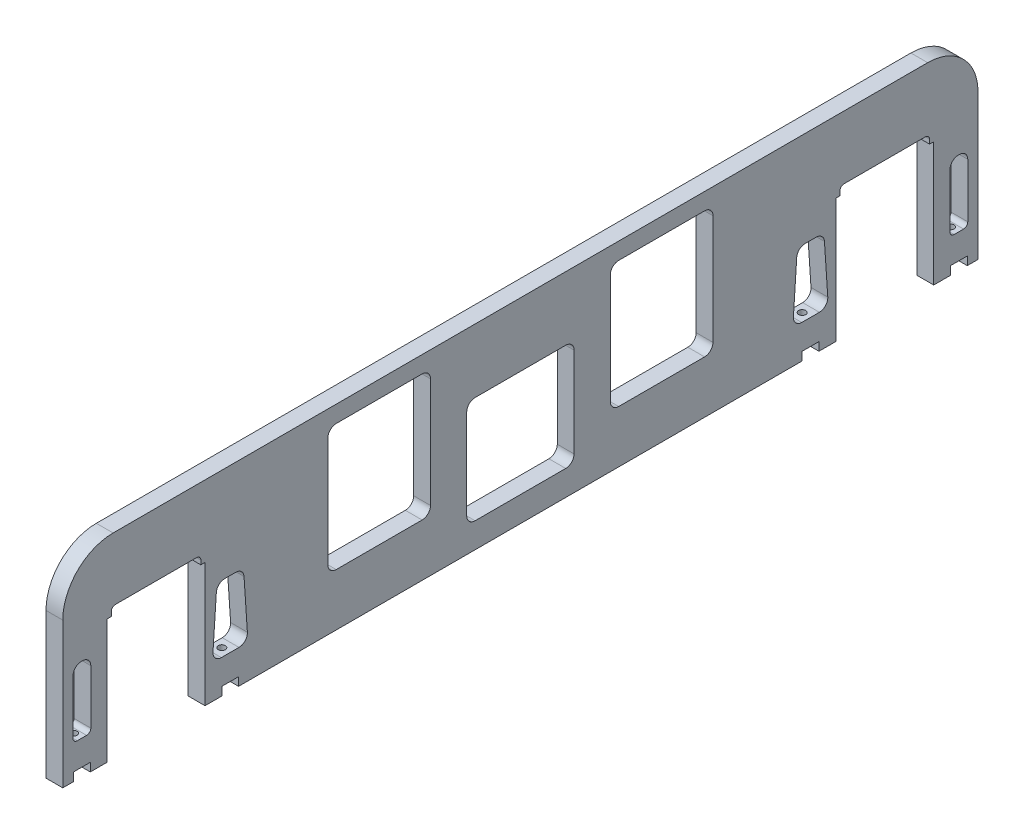
from build123d import *

# Parameters (mm, degrees)
BOSS_EXTRUDE1_DEPTH       = 6.35
FILLET1_R                 = 19.05
SKETCH2_W                 = 33.909
SKETCH2_H                 = 3.175
CUT_EXTRUDE1_DEPTH        = 189.494912836
FILLET2_R                 = 1.5875
FILLET2_OF_MIRROR1_R      = 1.5875
SKETCH3_W                 = 6.35
SKETCH3_H                 = 3.175
CUT_EXTRUDE2_DEPTH        = 189.494912836
SKETCH4_W                 = 38.862
SKETCH4_H                 = 47.879
SKETCH4_W_2               = 40.64
SKETCH4_H_2               = 40.386
CUT_EXTRUDE3_DEPTH        = 189.494912836
FILLET3_R                 = 3.175
SKETCH5_W                 = 6.731
SKETCH5_H                 = 25.24125
CUT_EXTRUDE4_DEPTH        = 189.494912836
FILLET4_R                 = 3.175
FILLET5_R                 = 1.5875
F_6_32_TAPPED_HOLE1_D     = 2.7051
F_6_32_TAPPED_HOLE1_DEPTH = 13.335
F_6_32_TAPPED_HOLE1_TIP   = 0.81269403


with BuildPart() as part:
    # Sketch1 → Boss-Extrude1 (new body)
    with BuildSketch(Plane(origin=(0, 0, 0), x_dir=(0, 0, -1), z_dir=(1, 0, 0))):
        Polygon((173.228, 74.041), (173.228, 0), (156.464, 0), (156.464, 46.99), (119.38, 46.99), (119.38, 0), (-119.38, 0), (-119.38, 46.99), (-156.464, 46.99), (-156.464, 0), (-173.228, 0), (-173.228, 74.041), align=None)
    extrude(amount=BOSS_EXTRUDE1_DEPTH)

    # Fillet1
    fillet1_edges = [part.edges().sort_by_distance(p)[0] for p in [
        (3.175, 74.041, 173.228),
        (3.175, 74.041, -173.228),
    ]]
    fillet(fillet1_edges, radius=FILLET1_R)

    # Sketch2 → Cut-Extrude1 (cut, through all)
    with BuildSketch(Plane(origin=(6.35, 0, 0), x_dir=(0, 0, -1), z_dir=(1, 0, 0))):
        with Locations((-137.922, 48.5775)):
            Rectangle(SKETCH2_W, SKETCH2_H)
    cut_extrude1 = extrude(amount=-CUT_EXTRUDE1_DEPTH, mode=Mode.SUBTRACT)

    # Fillet2
    fillet2_edges = [part.edges().sort_by_distance(p)[0] for p in [
        (3.175, 50.165, 154.8765),
        (3.175, 50.165, 120.9675),
    ]]
    fillet(fillet2_edges, radius=FILLET2_R)

    # Mirror1: Cut-Extrude1 across plane
    add(cut_extrude1.mirror(Plane.XY), mode=Mode.SUBTRACT)

    # Fillet2 of Mirror1
    fillet2_of_mirror1_edges = [part.edges().sort_by_distance(p)[0] for p in [
        (3.175, 50.165, -154.8765),
        (3.175, 50.165, -120.9675),
    ]]
    fillet(fillet2_of_mirror1_edges, radius=FILLET2_OF_MIRROR1_R)

    # Sketch3 → Cut-Extrude2 (cut, through all)
    with BuildSketch(Plane(origin=(6.35, 0, 0), x_dir=(0, 0, -1), z_dir=(1, 0, 0))):
        with Locations((-109.855, 1.5875)):
            Rectangle(SKETCH3_W, SKETCH3_H)
        with Locations((-165.989, 1.5875)):
            Rectangle(SKETCH3_W, SKETCH3_H)
    cut_extrude2 = extrude(amount=-CUT_EXTRUDE2_DEPTH, mode=Mode.SUBTRACT)

    # Mirror2: Cut-Extrude2 across plane
    add(cut_extrude2.mirror(Plane.XY), mode=Mode.SUBTRACT)

    # Sketch4 → Cut-Extrude3 (cut, through all)
    with BuildSketch(Plane(origin=(6.35, 0, 0), x_dir=(0, 0, -1), z_dir=(1, 0, 0))):
        with Locations((53.467, 43.7515)):
            Rectangle(SKETCH4_W, SKETCH4_H)
        with Locations((-53.467, 43.7515)):
            Rectangle(SKETCH4_W, SKETCH4_H)
        with Locations((0, 29.718)):
            Rectangle(SKETCH4_W_2, SKETCH4_H_2)
    extrude(amount=-CUT_EXTRUDE3_DEPTH, mode=Mode.SUBTRACT)

    # Fillet3
    fillet3_edges = [part.edges().sort_by_distance(p)[0] for p in [
        (3.175, 19.812, 72.898),
        (3.175, 67.691, 72.898),
        (3.175, 67.691, 34.036),
        (3.175, 19.812, 34.036),
        (3.175, 67.691, -34.036),
        (3.175, 67.691, -72.898),
        (3.175, 19.812, -72.898),
        (3.175, 19.812, -34.036),
        (3.175, 9.525, 20.32),
        (3.175, 49.911, 20.32),
        (3.175, 49.911, -20.32),
        (3.175, 9.525, -20.32),
    ]]
    fillet(fillet3_edges, radius=FILLET3_R)

    # Sketch5 → Cut-Extrude4 (cut, through all)
    with BuildSketch(Plane(origin=(6.35, 0, 0), x_dir=(0, 0, -1), z_dir=(1, 0, 0))):
        with Locations((165.989, 25.320625)):
            Rectangle(SKETCH5_W, SKETCH5_H)
        with Locations((-165.989, 25.320625)):
            Rectangle(SKETCH5_W, SKETCH5_H)
        Polygon((103.124, 12.7), (116.586, 12.7), (114.90325, 37.94125), (104.80675, 37.94125), align=None)
        Polygon((-103.124, 12.7), (-116.586, 12.7), (-114.90325, 37.94125), (-104.80675, 37.94125), align=None)
    extrude(amount=-CUT_EXTRUDE4_DEPTH, mode=Mode.SUBTRACT)

    # Fillet4
    fillet4_edges = [part.edges().sort_by_distance(p)[0] for p in [
        (3.175, 37.94125, -169.3545),
        (3.175, 37.94125, -162.6235),
        (3.175, 37.94125, 169.3545),
        (3.175, 37.94125, 162.6235),
        (3.175, 12.7, -103.124),
        (3.175, 37.94125, -104.80675),
        (3.175, 37.94125, -114.90325),
        (3.175, 12.7, -116.586),
        (3.175, 37.94125, 104.80675),
        (3.175, 12.7, 103.124),
        (3.175, 12.7, 116.586),
        (3.175, 37.94125, 114.90325),
    ]]
    fillet(fillet4_edges, radius=FILLET4_R)

    # Fillet5
    fillet5_edges = [part.edges().sort_by_distance(p)[0] for p in [
        (3.175, 12.7, -169.3545),
        (3.175, 12.7, -162.6235),
        (3.175, 12.7, 169.3545),
        (3.175, 12.7, 162.6235),
    ]]
    fillet(fillet5_edges, radius=FILLET5_R)

    # #6-32 Tapped Hole1
    with Locations(Plane(origin=(3.175, 3.175, 165.989), x_dir=(0, 0, -1), z_dir=(0, -1, 0))):
        with Locations((0, 0), (56.134, 0), (275.844, 0), (331.978, 0)):
            Hole(F_6_32_TAPPED_HOLE1_D / 2, depth=F_6_32_TAPPED_HOLE1_DEPTH)
            with Locations((0, 0, -(F_6_32_TAPPED_HOLE1_DEPTH + F_6_32_TAPPED_HOLE1_TIP / 2))):  # 118° drill point
                Cone(0, F_6_32_TAPPED_HOLE1_D / 2, F_6_32_TAPPED_HOLE1_TIP, mode=Mode.SUBTRACT)


solid = part.part
